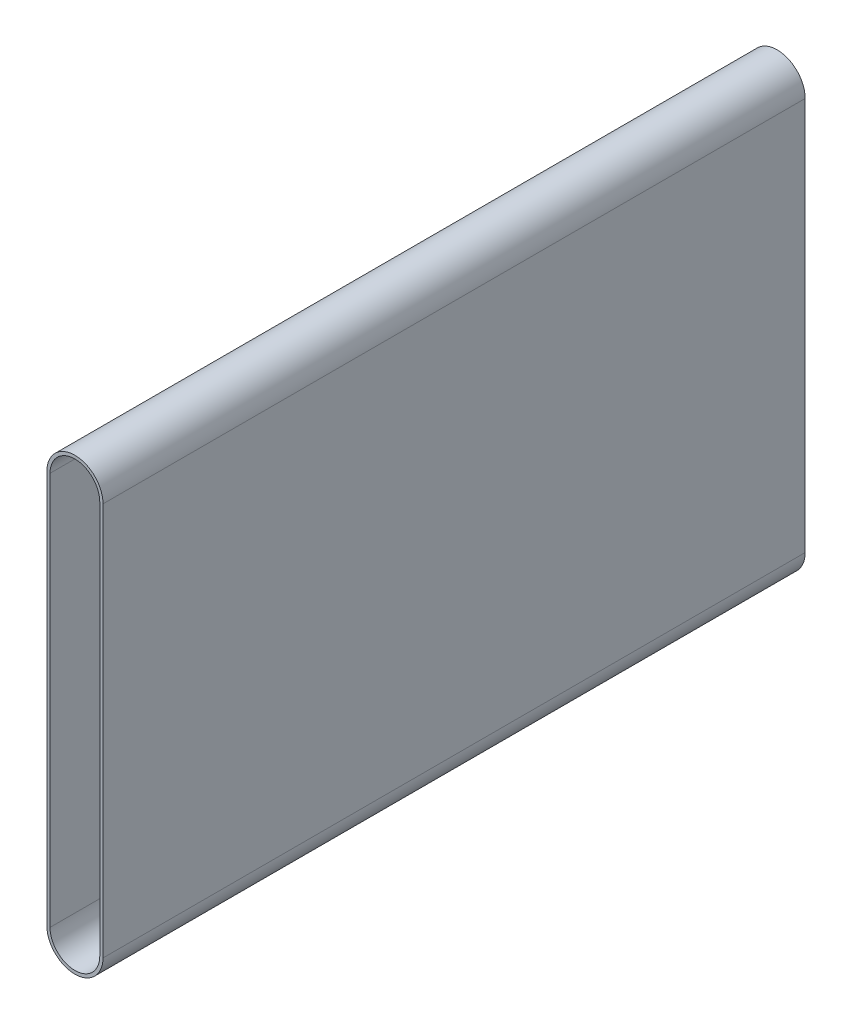
from build123d import *

# Parameters (mm, degrees)
BOSS_EXTRU_1_DEPTH      = 250
ENL_V_MAT_EXTRU_1_DEPTH = 250


with BuildPart() as part:
    # Esquisse1 → Boss.-Extru.1 (new body)
    with BuildSketch(Plane.XY):
        with BuildLine():
            Line((-10, 0), (-10, 140))
            ThreePointArc((-10, 140), (0, 150), (10, 140))
            Line((10, 140), (10, 0))
            ThreePointArc((10, 0), (0, -10), (-10, 0))
        make_face()
    extrude(amount=BOSS_EXTRU_1_DEPTH)

    # Esquisse2 → Enlèv. mat.-Extru.1 (cut)
    with BuildSketch(Plane.XY.offset(250)):
        with BuildLine():
            Line((8.856865258, 140), (8.856865258, 0))
            ThreePointArc((8.856865258, 0), (0, -8.856865258), (-8.856865258, 0))
            Line((-8.856865258, 0), (-8.856865258, 140))
            ThreePointArc((-8.856865258, 140), (0, 148.856865258), (8.856865258, 140))
        make_face()
    extrude(amount=-ENL_V_MAT_EXTRU_1_DEPTH, mode=Mode.SUBTRACT)


solid = part.part
